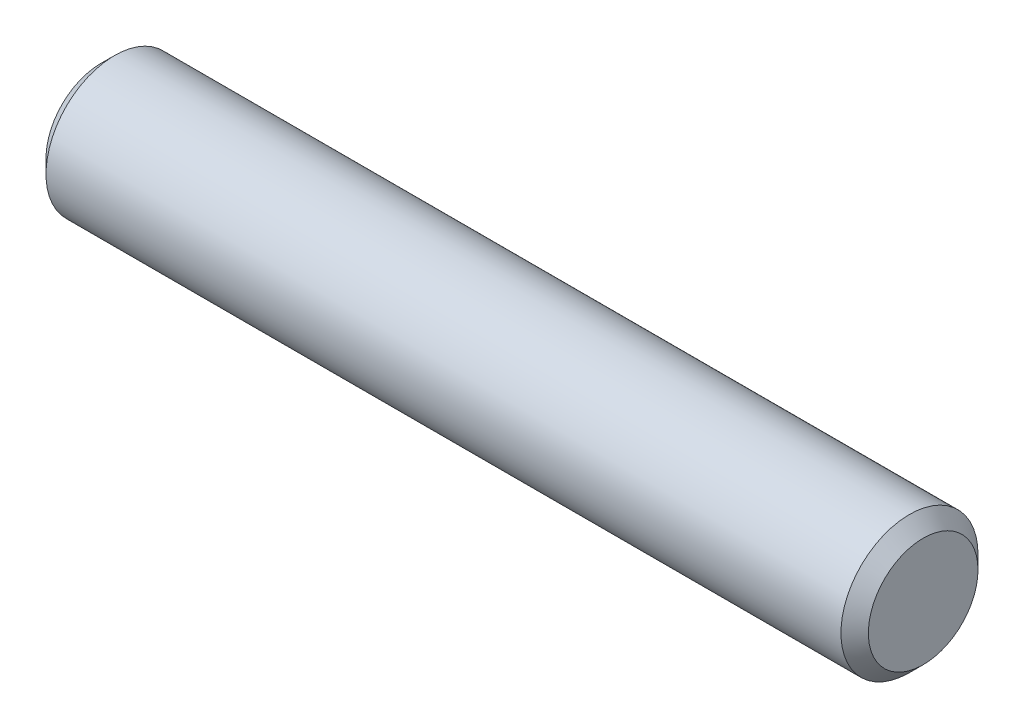
from build123d import *

# Parameters (mm, degrees)
SKETCH1_R           = 2.5
BOSS_EXTRUDE1_DEPTH = 30
CHAMFER1_SIZE       = 0.5


with BuildPart() as part:
    # Sketch1 → Boss-Extrude1 (new body)
    with BuildSketch(Plane(origin=(0, 0, 0), x_dir=(0, 0, -1), z_dir=(1, 0, 0))):
        Circle(SKETCH1_R)
    extrude(amount=BOSS_EXTRUDE1_DEPTH)

    # Chamfer1
    chamfer1_edges = [part.edges().sort_by_distance(p)[0] for p in [
        (0, 0, 2.5),
        (30, 0, 2.5),
    ]]
    chamfer(chamfer1_edges, length=CHAMFER1_SIZE)


solid = part.part
